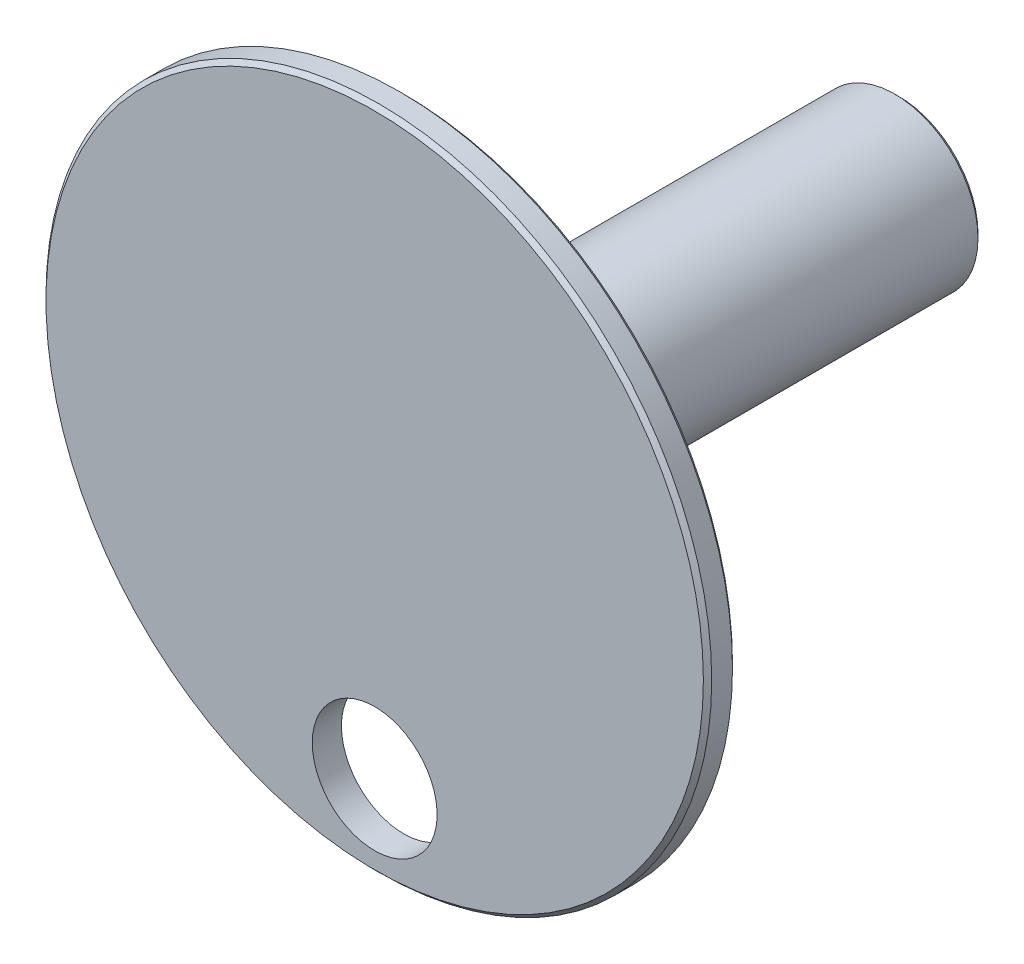
from build123d import *

# Parameters (mm, degrees)
SKETCH2_R           = 2
BOSS_EXTRUDE1_DEPTH = 11.6
SKETCH3_R           = 4
BOSS_EXTRUDE2_DEPTH = 0.3
SKETCH4_R           = 8
BOSS_EXTRUDE3_DEPTH = 0.7
SKETCH5_R           = 1.5
CUT_EXTRUDE1_DEPTH  = 8.5
SKETCH7_R           = 1.5
CUT_EXTRUDE2_DEPTH  = 17.419805115
CHAMFER1_SIZE       = 0.1


with BuildPart() as part:
    # Sketch2 → Boss-Extrude1 (new body)
    with BuildSketch(Plane.XY):
        Circle(SKETCH2_R)
    extrude(amount=BOSS_EXTRUDE1_DEPTH)

    # Sketch3 → Boss-Extrude2 (add)
    with BuildSketch(Plane.XY.offset(11.6)):
        Circle(SKETCH3_R)
    extrude(amount=BOSS_EXTRUDE2_DEPTH)

    # Sketch4 → Boss-Extrude3 (add)
    with BuildSketch(Plane.XY.offset(11.9)):
        Circle(SKETCH4_R)
    extrude(amount=BOSS_EXTRUDE3_DEPTH)

    # Sketch5 → Cut-Extrude1 (cut)
    with BuildSketch(Plane(origin=(0, 0, 0), x_dir=(-1, 0, 0), z_dir=(0, 0, -1))):
        Circle(SKETCH5_R)
    extrude(amount=-CUT_EXTRUDE1_DEPTH, mode=Mode.SUBTRACT)

    # Sketch7 → Cut-Extrude2 (cut, through all)
    with BuildSketch(Plane(origin=(0, 0, 11.9), x_dir=(-1, 0, 0), z_dir=(0, 0, -1))):
        with Locations((0, -6)):
            Circle(SKETCH7_R)
    extrude(amount=-CUT_EXTRUDE2_DEPTH, mode=Mode.SUBTRACT)

    # Chamfer1
    chamfer1_edges = [part.edges().sort_by_distance(p)[0] for p in [
        (-8, 0, 12.6),
        (-2, 0, 0),
        (-8, 0, 11.9),
    ]]
    chamfer(chamfer1_edges, length=CHAMFER1_SIZE)


solid = part.part
